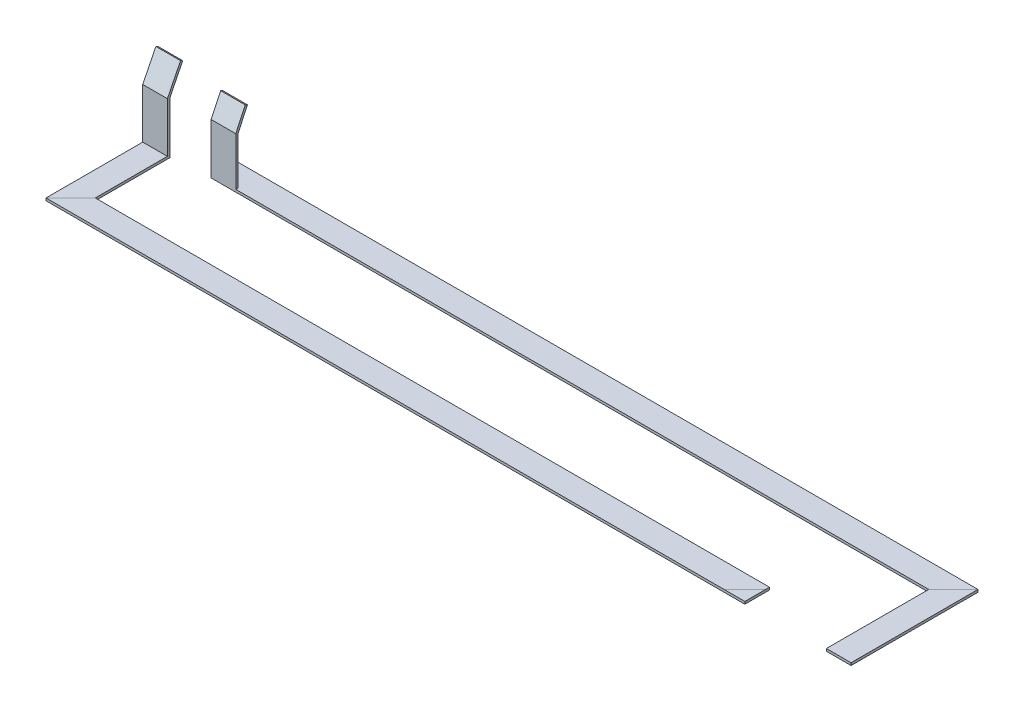
from build123d import *

# Parameters (mm, degrees)
CROQUIS2_W              = 63.5
CROQUIS2_H              = 6.31
CROQUIS3_W              = 63.5
CROQUIS3_H              = 6.31
CROQUIS4_W              = 60
CROQUIS4_H              = 53.155
SALIENTE_EXTRUIR1_DEPTH = 6.31
CROQUIS5_W              = 60
CROQUIS5_H              = 6.31
CORTAR_EXTRUIR1_DEPTH   = 6.31
CORTAR_EXTRUIR2_DEPTH   = 502
CROQUIS8_W              = 63.5
CROQUIS8_H              = 564.085
CORTAR_EXTRUIR3_DEPTH   = 502
CROQUIS9_W              = 327
CROQUIS9_H              = 1084.052933
CORTAR_EXTRUIR4_DEPTH   = 502
CROQUIS10_W             = 63.5
CROQUIS10_H             = 6.31
CORTAR_EXTRUIR5_DEPTH   = 95
CORTAR_EXTRUIR6_DEPTH   = 95
CROQUIS13_W             = 120
CROQUIS13_H             = 256.105
CORTAR_EXTRUIR7_DEPTH   = 95
CROQUIS16_W             = 125
CROQUIS16_H             = 63.5
SALIENTE_EXTRUIR4_DEPTH = 6.31
CROQUIS17_W             = 63.5
CROQUIS17_H             = 6.31
SALIENTE_EXTRUIR5_DEPTH = 63.5
CROQUIS19_W             = 63.5
CROQUIS19_H             = 25.642933
CORTAR_EXTRUIR8_DEPTH   = 63.5
SALIENTE_EXTRUIR6_DEPTH = 63.5
CROQUIS21_W             = 10
CROQUIS21_H             = 63.5
CORTAR_EXTRUIR9_DEPTH   = 53


with BuildPart() as part:
    # Barrer1: sweep along a curve in space
    with BuildLine() as barrer1_path:
        Line((0, 0, 0), (0, -567.24, 0))
        Line((0, -567.24, 0), (0, -567.24, 316.2))
        Line((0, -567.24, 316.2), (1786.7, -567.24, 316.2))
        Line((1786.7, -567.24, 316.2), (1786.7, -567.24, 578))
        Line((1786.7, -567.24, 578), (1786.7, -435.47278313, 578))
        Line((1786.7, -435.47278313, 578), (1786.7, -435.47278313, 1432.002933))
    # Croquis2 → Barrer1 (sweep)
    with BuildSketch(Plane(origin=(0, 0, 0), x_dir=(1, 0, 0), z_dir=(0, 1, 0))):
        Rectangle(CROQUIS2_W, CROQUIS2_H)
        with Locations((263.5, 0)):
            Rectangle(CROQUIS2_W, CROQUIS2_H)
    sweep(path=barrer1_path.line, transition=Transition.RIGHT)

    # Barrer4: sweep along a curve in space
    with BuildLine() as barrer4_path:
        Line((-0.201028049, -3.155, -3.155), (-0.201028049, -3.155, -207.155))
        Line((-0.201028049, -3.155, -207.155), (-0.201028049, -53.155, -207.155))
    # Croquis3 → Barrer4 (sweep)
    with BuildSketch(Plane(origin=(0, 0, -3.155), x_dir=(-1, 0, 0), z_dir=(0, 0, -1))):
        with Locations((-263.5, -3.155)):
            Rectangle(CROQUIS3_W, CROQUIS3_H)
        with Locations((0, -3.155)):
            Rectangle(CROQUIS3_W, CROQUIS3_H)
    sweep(path=barrer4_path.line, transition=Transition.RIGHT)

    # Croquis4 → Saliente-Extruir1 (add)
    with BuildSketch(Plane(origin=(0, 0, -210.31), x_dir=(-1, 0, 0), z_dir=(0, 0, -1))):
        with Locations((-201.75, -26.5775)):
            Rectangle(CROQUIS4_W, CROQUIS4_H)
    extrude(amount=-SALIENTE_EXTRUIR1_DEPTH)

    # Croquis5 → Cortar-Extruir1 (cut)
    with BuildSketch(Plane.XY.offset(-204)):
        with Locations((201.75, -3.155)):
            Rectangle(CROQUIS5_W, CROQUIS5_H)
    extrude(amount=-CORTAR_EXTRUIR1_DEPTH, mode=Mode.SUBTRACT)

    # Croquis7 → Cortar-Extruir2 (cut)
    with BuildSketch(Plane.XY.offset(3.155)):
        Polygon((295.25, -564.085), (231.75, -564.085), (231.75, -68.875540851), (170.611072112, -68.875540851), (170.611072112, 0), (295.25, 0), align=None)
    extrude(amount=-CORTAR_EXTRUIR2_DEPTH, mode=Mode.SUBTRACT)

    # Croquis8 → Cortar-Extruir3 (cut)
    with BuildSketch(Plane.XY.offset(3.155)):
        with Locations((0, -282.0425)):
            Rectangle(CROQUIS8_W, CROQUIS8_H)
    extrude(amount=-CORTAR_EXTRUIR3_DEPTH, mode=Mode.SUBTRACT)

    # Croquis9 → Cortar-Extruir4 (cut)
    with BuildSketch(Plane(origin=(0, -432.31778313, 0), x_dir=(1, 0, 0), z_dir=(0, 1, 0))):
        with Locations((1918.45, -889.9764665)):
            Rectangle(CROQUIS9_W, CROQUIS9_H)
    extrude(amount=-CORTAR_EXTRUIR4_DEPTH, mode=Mode.SUBTRACT)

    # Croquis10 → Cortar-Extruir5 (cut)
    with BuildSketch(Plane(origin=(0, 0, -3.155), x_dir=(-1, 0, 0), z_dir=(0, 0, -1))):
        with Locations((0, -567.24)):
            Rectangle(CROQUIS10_W, CROQUIS10_H)
    extrude(amount=-CORTAR_EXTRUIR5_DEPTH, mode=Mode.SUBTRACT)

    # Croquis11 → Cortar-Extruir6 (cut)
    with BuildSketch(Plane(origin=(0, -564.085, 0), x_dir=(1, 0, 0), z_dir=(0, 1, 0))):
        Polygon((231.75, -84.45), (295.25, -84.45), (295.25, -20.95), align=None)
        Polygon((231.75, -84.45), (295.25, -20.95), (231.75, -20.95), align=None)
        Polygon((231.75, -20.95), (295.25, -20.95), (295.25, -3.155), (295.25, 3.155), (231.75, 3.155), (231.75, -3.155), align=None)
    extrude(amount=-CORTAR_EXTRUIR6_DEPTH, mode=Mode.SUBTRACT)

    # Croquis13 → Cortar-Extruir7 (cut)
    with BuildSketch(Plane(origin=(0, -564.085, 0), x_dir=(1, 0, 0), z_dir=(0, 1, 0))):
        with Locations((28.25, -219.8975)):
            Rectangle(CROQUIS13_W, CROQUIS13_H)
    extrude(amount=-CORTAR_EXTRUIR7_DEPTH, mode=Mode.SUBTRACT)

    # Croquis16 → Saliente-Extruir4 (add)
    with BuildSketch(Plane(origin=(0, -564.085, 0), x_dir=(1, 0, 0), z_dir=(0, 1, 0))):
        with Locations((232.75, -52.7)):
            Rectangle(CROQUIS16_W, CROQUIS16_H)
    extrude(amount=-SALIENTE_EXTRUIR4_DEPTH)

    # Barrer5: sweep along a curve in space
    with BuildLine() as barrer5_path:
        Line((88.25, -567.24, 316.2), (40.2, -567.24, 316.2))
        Line((40.2, -567.24, 316.2), (40.2, -567.24, 66.2))
    # Croquis17 → Barrer5 (sweep)
    with BuildSketch(Plane.ZY.offset(-88.25)):
        with Locations((316.2, -567.24)):
            Rectangle(CROQUIS17_W, CROQUIS17_H)
    sweep(path=barrer5_path.line, transition=Transition.RIGHT)

    # Croquis18 → Saliente-Extruir5 (add)
    with BuildSketch(Plane.ZY.offset(-8.45)):
        Polygon((98.787204793, -564.085), (98.787204793, -435.522965931), (64.969988324, -367.622744457), (59.321737777, -370.435814978), (91.897545374, -435.843461779), (91.842933, -564.085), align=None)
    extrude(amount=-SALIENTE_EXTRUIR5_DEPTH)

    # Croquis19 → Cortar-Extruir8 (cut)
    with BuildSketch(Plane(origin=(0, -564.085, 0), x_dir=(1, 0, 0), z_dir=(0, 1, 0))):
        with Locations((40.2, -79.0214665)):
            Rectangle(CROQUIS19_W, CROQUIS19_H)
    extrude(amount=-CORTAR_EXTRUIR8_DEPTH, mode=Mode.SUBTRACT)

    # Croquis20 → Saliente-Extruir6 (add)
    with BuildSketch(Plane.ZY.offset(-170.25)):
        Polygon((84.45, -564.085), (84.45, -439.884522326), (59.966060883, -387.925515276), (54.258037161, -390.615229981), (78.14, -441.296742852), (78.14, -564.085), align=None)
    extrude(amount=-SALIENTE_EXTRUIR6_DEPTH)

    # Croquis21 → Cortar-Extruir9 (cut)
    with BuildSketch(Plane(origin=(0, -564.085, 0), x_dir=(1, 0, 0), z_dir=(0, 1, 0))):
        with Locations((1813.45, -316.2)):
            Rectangle(CROQUIS21_W, CROQUIS21_H)
    extrude(amount=-CORTAR_EXTRUIR9_DEPTH, mode=Mode.SUBTRACT)


solid = part.part
